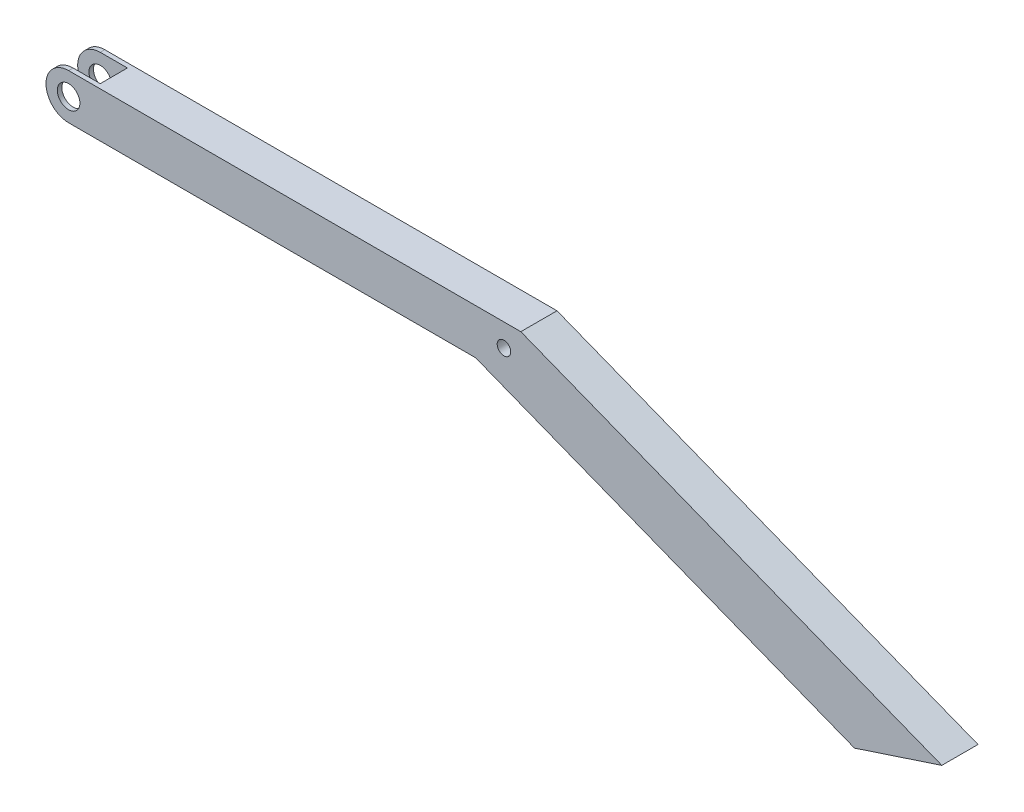
from build123d import *

# Parameters (mm, degrees)
SKETCH_1_R          = 2.5
SKETCH_1_R_2        = 1.5
EXTRUDE_2_DEPTH     = 4
CUT_EXTRUDE_1_DEPTH = 3


with BuildPart() as part:
    # 草图1 → 凸台-拉伸2 (new, symmetric)
    with BuildSketch(Plane.XY):
        with BuildLine():
            Line((-83.231357553, 14.560229446), (-43.231357553, 14.560229446))
            Line((-43.231357553, 14.560229446), (16.768642447, 14.560229446))
            Line((16.768642447, 14.560229446), (109.865069812, -21.95079919))
            Line((109.865069812, -21.95079919), (90.555427075, -28.299696326))
            Line((90.555427075, -28.299696326), (6.768642447, 4.560229446))
            Line((6.768642447, 4.560229446), (-43.231357553, 4.560229446))
            Line((-43.231357553, 4.560229446), (-83.231357553, 4.560229446))
            ThreePointArc((-83.231357553, 4.560229446), (-88.231357553, 9.560229446), (-83.231357553, 14.560229446))
        make_face()
        with Locations((-83.231357553, 9.560229446)):
            Circle(SKETCH_1_R, mode=Mode.SUBTRACT)
        with Locations((13.041147127, 9.560229446)):
            Circle(SKETCH_1_R_2, mode=Mode.SUBTRACT)
    extrude(amount=EXTRUDE_2_DEPTH, both=True)

    # 草图2 → 切除-拉伸1 (cut, symmetric)
    with BuildSketch(Plane.XY):
        with BuildLine():
            Line((-83.231357553, 4.560229446), (-77.231357553, 4.560229446))
            Line((-77.231357553, 4.560229446), (-77.231357553, 14.560229446))
            Line((-77.231357553, 14.560229446), (-83.231357553, 14.560229446))
            ThreePointArc((-83.231357553, 14.560229446), (-88.231357553, 9.560229446), (-83.231357553, 4.560229446))
        make_face()
    extrude(amount=CUT_EXTRUDE_1_DEPTH, both=True, mode=Mode.SUBTRACT)


solid = part.part
